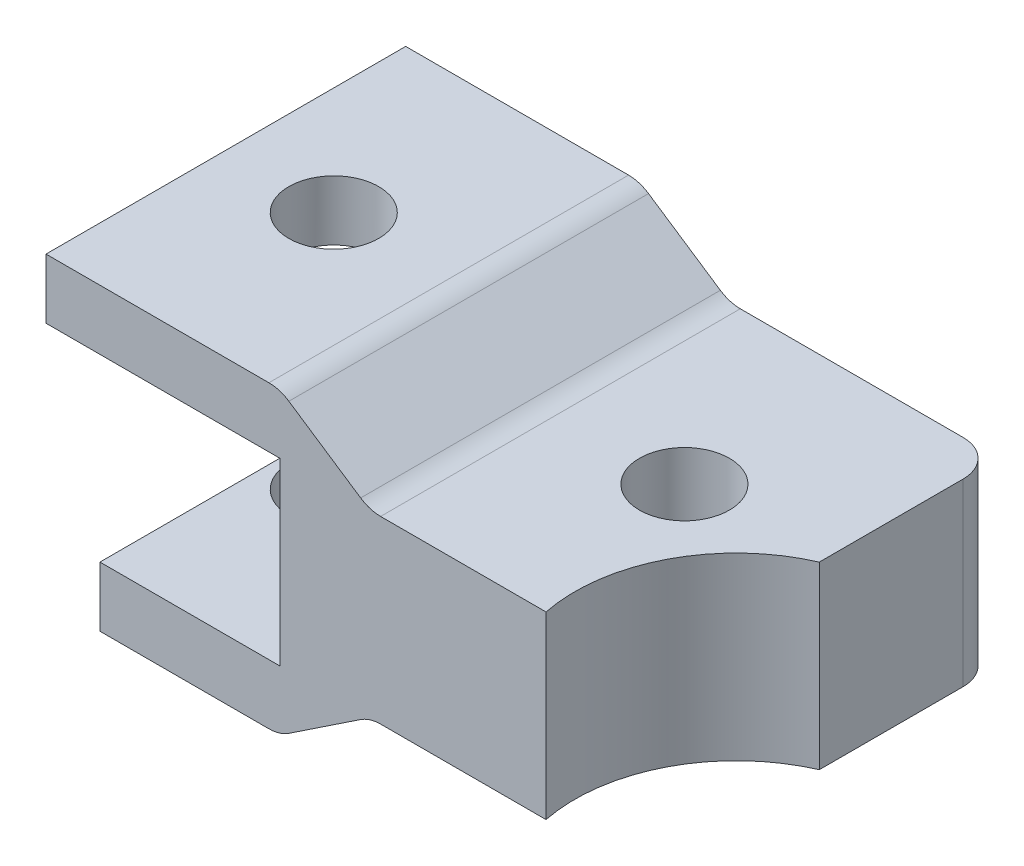
from build123d import *

# Parameters (mm, degrees)
SKETCH1_W               = 12.7
SKETCH1_H               = 4.23164
SKETCH1_W_2             = 16.51
BOSS_EXTRUDE1_DEPTH     = 25.4
CUT_EXTRUDE4_DEPTH      = 49.820594354
CUT_EXTRUDE4_DEPTH_BACK = 49.820594354
SKETCH4_R               = 3.175
CUT_EXTRUDE5_DEPTH      = 49.820594354
CUT_EXTRUDE5_DEPTH_BACK = 49.820594354
SKETCH6_R               = 3.175
CUT_EXTRUDE6_DEPTH      = 49.820594354
CUT_EXTRUDE6_DEPTH_BACK = 49.820594354
FILLET2_R               = 2.54


with BuildPart() as part:
    # Sketch1 → Boss-Extrude1 (new body)
    with BuildSketch(Plane.XY):
        with Locations((6.35, -2.11582)):
            Rectangle(SKETCH1_W, SKETCH1_H)
        Polygon((19.05, 0), (38.1, 0), (38.1, 12.7), (19.05, 12.7), (12.7, 16.93164), (12.7, 12.7), (12.7, 0), (12.7, -4.23164), align=None)
        with Locations((4.445, 14.81582)):
            Rectangle(SKETCH1_W_2, SKETCH1_H)
    extrude(amount=BOSS_EXTRUDE1_DEPTH)

    # Sketch4 → Cut-Extrude4 (cut, two sides: drawn at the far end of the back side and taken through both)
    with BuildSketch(Plane(origin=(0, 0, 0), x_dir=(1, 0, 0), z_dir=(0, 1, 0)).offset(-CUT_EXTRUDE4_DEPTH_BACK)):
        with Locations(Location((3.81, -12.7, 0), (0, 0, 270))):
            Circle(SKETCH4_R)
    extrude(amount=CUT_EXTRUDE4_DEPTH + CUT_EXTRUDE4_DEPTH_BACK, mode=Mode.SUBTRACT)

    # Sketch6 → Cut-Extrude5 (cut, two sides: drawn at the far end of the back side and taken through both)
    with BuildSketch(Plane(origin=(0, 12.7, 0), x_dir=(1, 0, 0), z_dir=(0, 1, 0)).offset(-CUT_EXTRUDE5_DEPTH_BACK)):
        with Locations(Location((28.575, -12.7, 0), (0, 0, 270))):
            Circle(SKETCH6_R)
    extrude(amount=CUT_EXTRUDE5_DEPTH + CUT_EXTRUDE5_DEPTH_BACK, mode=Mode.SUBTRACT)

    # Sketch7 → Cut-Extrude6 (cut, two sides: drawn at the far end of the back side and taken through both)
    with BuildSketch(Plane(origin=(0, 12.7, 0), x_dir=(1, 0, 0), z_dir=(0, 1, 0)).offset(-CUT_EXTRUDE6_DEPTH_BACK)):
        with BuildLine():
            Line((38.1, -12.7), (38.1, -25.4))
            Line((38.1, -25.4), (31.500264821, -25.4))
            ThreePointArc((31.500264821, -25.4), (32.55839158, -17.885047573), (38.1, -12.7))
        make_face()
    extrude(amount=CUT_EXTRUDE6_DEPTH + CUT_EXTRUDE6_DEPTH_BACK, mode=Mode.SUBTRACT)

    # Fillet2
    fillet2_edges = [part.edges().sort_by_distance(p)[0] for p in [
        (38.1, 6.35, 0),
        (12.7, 16.93164, 12.7),
        (19.05, 12.7, 12.7),
        (19.05, 0, 12.7),
        (12.7, -4.23164, 12.7),
    ]]
    fillet(fillet2_edges, radius=FILLET2_R)


solid = part.part
